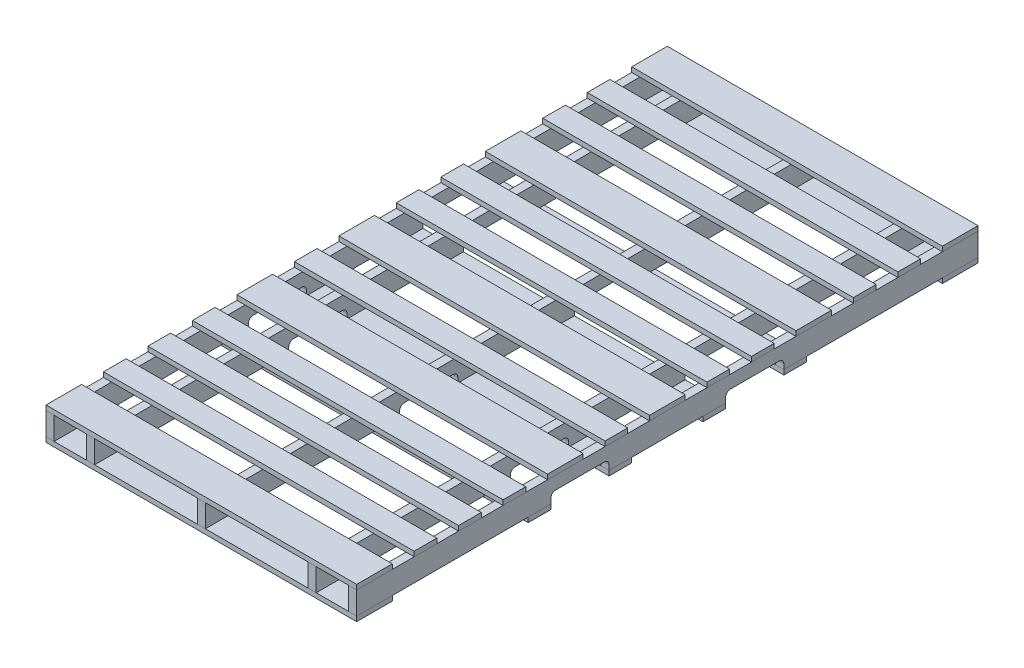
from build123d import *

# Parameters (mm, degrees)
BOSS_EXTRUDE1_DEPTH        = 1219.2
BOSS_EXTRUDE1_DEPTH_BACK   = 1219.2
SKETCH3_W                  = 31.75
SKETCH3_H                  = 88.9
BOSS_EXTRUDE1_2_DEPTH      = 1219.2
BOSS_EXTRUDE1_2_DEPTH_BACK = 1219.2
BOSS_EXTRUDE1_3_DEPTH      = 1219.2
BOSS_EXTRUDE1_3_DEPTH_BACK = 1219.2
BOSS_EXTRUDE1_4_DEPTH      = 1219.2
BOSS_EXTRUDE1_4_DEPTH_BACK = 1219.2
BOSS_EXTRUDE1_5_DEPTH      = 1219.2
BOSS_EXTRUDE1_5_DEPTH_BACK = 1219.2
SKETCH4_W                  = 1219.2
SKETCH4_H                  = 139.7
BOSS_EXTRUDE2_DEPTH        = 19.05
BOSS_EXTRUDE2_2_DEPTH      = 19.05
BOSS_EXTRUDE2_3_DEPTH      = 19.05
SKETCH4_H_2                = 88.9
BOSS_EXTRUDE2_4_DEPTH      = 19.05
BOSS_EXTRUDE2_5_DEPTH      = 19.05
BOSS_EXTRUDE2_6_DEPTH      = 19.05
BOSS_EXTRUDE2_7_DEPTH      = 19.05
BOSS_EXTRUDE2_8_DEPTH      = 19.05
BOSS_EXTRUDE2_9_DEPTH      = 19.05
BOSS_EXTRUDE2_10_DEPTH     = 19.05
BOSS_EXTRUDE2_11_DEPTH     = 19.05
BOSS_EXTRUDE2_12_DEPTH     = 19.05
BOSS_EXTRUDE2_13_DEPTH     = 19.05
SKETCH5_W                  = 1219.2
SKETCH5_H                  = 139.7
BOSS_EXTRUDE3_DEPTH        = 19.05
BOSS_EXTRUDE3_2_DEPTH      = 19.05
SKETCH5_H_2                = 88.9
BOSS_EXTRUDE3_3_DEPTH      = 19.05
BOSS_EXTRUDE3_4_DEPTH      = 19.05
BOSS_EXTRUDE3_5_DEPTH      = 19.05
BOSS_EXTRUDE3_6_DEPTH      = 19.05
CUT_EXTRUDE2_DEPTH         = 1726.378083204
CUT_EXTRUDE2_DEPTH_BACK    = 1726.378083204


with BuildPart() as part:
    # Sketch3 → Boss-Extrude1 (new, two sides: drawn at the far end of the back side and taken through both)
    with BuildSketch(Plane.XY.offset(-BOSS_EXTRUDE1_DEPTH_BACK)):
        with Locations((-593.725, 0)):
            Rectangle(SKETCH3_W, SKETCH3_H)
    extrude(amount=BOSS_EXTRUDE1_DEPTH + BOSS_EXTRUDE1_DEPTH_BACK)


with BuildPart() as body_2:
    # Sketch3 → Boss-Extrude1 2 (new, two sides: drawn at the far end of the back side and taken through both)
    with BuildSketch(Plane.XY.offset(-BOSS_EXTRUDE1_2_DEPTH_BACK)):
        with Locations((434.975, 0)):
            Rectangle(SKETCH3_W, SKETCH3_H)
    extrude(amount=BOSS_EXTRUDE1_2_DEPTH + BOSS_EXTRUDE1_2_DEPTH_BACK)


with BuildPart() as body_3:
    # Sketch3 → Boss-Extrude1 3 (new, two sides: drawn at the far end of the back side and taken through both)
    with BuildSketch(Plane.XY.offset(-BOSS_EXTRUDE1_3_DEPTH_BACK)):
        with Locations((593.725, 0)):
            Rectangle(SKETCH3_W, SKETCH3_H)
    extrude(amount=BOSS_EXTRUDE1_3_DEPTH + BOSS_EXTRUDE1_3_DEPTH_BACK)


with BuildPart() as body_4:
    # Sketch3 → Boss-Extrude1 4 (new, two sides: drawn at the far end of the back side and taken through both)
    with BuildSketch(Plane.XY.offset(-BOSS_EXTRUDE1_4_DEPTH_BACK)):
        with Locations((-434.975, 0)):
            Rectangle(SKETCH3_W, SKETCH3_H)
    extrude(amount=BOSS_EXTRUDE1_4_DEPTH + BOSS_EXTRUDE1_4_DEPTH_BACK)


with BuildPart() as body_5:
    # Sketch3 → Boss-Extrude1 5 (new, two sides: drawn at the far end of the back side and taken through both)
    with BuildSketch(Plane.XY.offset(-BOSS_EXTRUDE1_5_DEPTH_BACK)):
        Rectangle(SKETCH3_W, SKETCH3_H)
    extrude(amount=BOSS_EXTRUDE1_5_DEPTH + BOSS_EXTRUDE1_5_DEPTH_BACK)


with BuildPart() as body_6:
    # Sketch4 → Boss-Extrude2 (new body)
    with BuildSketch(Plane(origin=(0, 44.45, 0), x_dir=(1, 0, 0), z_dir=(0, 1, 0))):
        with Locations((0, -1149.35)):
            Rectangle(SKETCH4_W, SKETCH4_H)
    extrude(amount=BOSS_EXTRUDE2_DEPTH)


with BuildPart() as body_7:
    # Sketch4 → Boss-Extrude2 2 (new body)
    with BuildSketch(Plane(origin=(0, 44.45, 0), x_dir=(1, 0, 0), z_dir=(0, 1, 0))):
        with Locations((0, 1149.35)):
            Rectangle(SKETCH4_W, SKETCH4_H)
    extrude(amount=BOSS_EXTRUDE2_2_DEPTH)


with BuildPart() as body_8:
    # Sketch4 → Boss-Extrude2 3 (new body)
    with BuildSketch(Plane(origin=(0, 44.45, 0), x_dir=(1, 0, 0), z_dir=(0, 1, 0))):
        with Locations((0, -400.05)):
            Rectangle(SKETCH4_W, SKETCH4_H)
    extrude(amount=BOSS_EXTRUDE2_3_DEPTH)


with BuildPart() as body_9:
    # Sketch4 → Boss-Extrude2 4 (new body)
    with BuildSketch(Plane(origin=(0, 44.45, 0), x_dir=(1, 0, 0), z_dir=(0, 1, 0))):
        with Locations((0, -200.025)):
            Rectangle(SKETCH4_W, SKETCH4_H_2)
    extrude(amount=BOSS_EXTRUDE2_4_DEPTH)


with BuildPart() as body_10:
    # Sketch4 → Boss-Extrude2 5 (new body)
    with BuildSketch(Plane(origin=(0, 44.45, 0), x_dir=(1, 0, 0), z_dir=(0, 1, 0))):
        with Locations((0, 949.325)):
            Rectangle(SKETCH4_W, SKETCH4_H_2)
    extrude(amount=BOSS_EXTRUDE2_5_DEPTH)


with BuildPart() as body_11:
    # Sketch4 → Boss-Extrude2 6 (new body)
    with BuildSketch(Plane(origin=(0, 44.45, 0), x_dir=(1, 0, 0), z_dir=(0, 1, 0))):
        with Locations((0, 200.025)):
            Rectangle(SKETCH4_W, SKETCH4_H_2)
    extrude(amount=BOSS_EXTRUDE2_6_DEPTH)


with BuildPart() as body_12:
    # Sketch4 → Boss-Extrude2 7 (new body)
    with BuildSketch(Plane(origin=(0, 44.45, 0), x_dir=(1, 0, 0), z_dir=(0, 1, 0))):
        Rectangle(SKETCH4_W, SKETCH4_H)
    extrude(amount=BOSS_EXTRUDE2_7_DEPTH)


with BuildPart() as body_13:
    # Sketch4 → Boss-Extrude2 8 (new body)
    with BuildSketch(Plane(origin=(0, 44.45, 0), x_dir=(1, 0, 0), z_dir=(0, 1, 0))):
        with Locations((0, 774.7)):
            Rectangle(SKETCH4_W, SKETCH4_H_2)
    extrude(amount=BOSS_EXTRUDE2_8_DEPTH)


with BuildPart() as body_14:
    # Sketch4 → Boss-Extrude2 9 (new body)
    with BuildSketch(Plane(origin=(0, 44.45, 0), x_dir=(1, 0, 0), z_dir=(0, 1, 0))):
        with Locations((0, 574.675)):
            Rectangle(SKETCH4_W, SKETCH4_H)
    extrude(amount=BOSS_EXTRUDE2_9_DEPTH)


with BuildPart() as body_15:
    # Sketch4 → Boss-Extrude2 10 (new body)
    with BuildSketch(Plane(origin=(0, 44.45, 0), x_dir=(1, 0, 0), z_dir=(0, 1, 0))):
        with Locations((0, 374.65)):
            Rectangle(SKETCH4_W, SKETCH4_H_2)
    extrude(amount=BOSS_EXTRUDE2_10_DEPTH)


with BuildPart() as body_16:
    # Sketch4 → Boss-Extrude2 11 (new body)
    with BuildSketch(Plane(origin=(0, 44.45, 0), x_dir=(1, 0, 0), z_dir=(0, 1, 0))):
        with Locations((0, -600.075)):
            Rectangle(SKETCH4_W, SKETCH4_H_2)
    extrude(amount=BOSS_EXTRUDE2_11_DEPTH)


with BuildPart() as body_17:
    # Sketch4 → Boss-Extrude2 12 (new body)
    with BuildSketch(Plane(origin=(0, 44.45, 0), x_dir=(1, 0, 0), z_dir=(0, 1, 0))):
        with Locations((0, -774.7)):
            Rectangle(SKETCH4_W, SKETCH4_H_2)
    extrude(amount=BOSS_EXTRUDE2_12_DEPTH)


with BuildPart() as body_18:
    # Sketch4 → Boss-Extrude2 13 (new body)
    with BuildSketch(Plane(origin=(0, 44.45, 0), x_dir=(1, 0, 0), z_dir=(0, 1, 0))):
        with Locations((0, -949.325)):
            Rectangle(SKETCH4_W, SKETCH4_H_2)
    extrude(amount=BOSS_EXTRUDE2_13_DEPTH)


with BuildPart() as body_19:
    # Sketch5 → Boss-Extrude3 (new body)
    with BuildSketch(Plane.XZ.offset(44.45)):
        with Locations((0, 1149.35)):
            Rectangle(SKETCH5_W, SKETCH5_H)
    extrude(amount=BOSS_EXTRUDE3_DEPTH)


with BuildPart() as body_20:
    # Sketch5 → Boss-Extrude3 2 (new body)
    with BuildSketch(Plane.XZ.offset(44.45)):
        with Locations((0, -1149.35)):
            Rectangle(SKETCH5_W, SKETCH5_H)
    extrude(amount=BOSS_EXTRUDE3_2_DEPTH)


with BuildPart() as body_21:
    # Sketch5 → Boss-Extrude3 3 (new body)
    with BuildSketch(Plane.XZ.offset(44.45)):
        with Locations((0, -184.15)):
            Rectangle(SKETCH5_W, SKETCH5_H_2)
    extrude(amount=BOSS_EXTRUDE3_3_DEPTH)


with BuildPart() as body_22:
    # Sketch5 → Boss-Extrude3 4 (new body)
    with BuildSketch(Plane.XZ.offset(44.45)):
        with Locations((0, 501.65)):
            Rectangle(SKETCH5_W, SKETCH5_H_2)
    extrude(amount=BOSS_EXTRUDE3_4_DEPTH)


with BuildPart() as body_23:
    # Sketch5 → Boss-Extrude3 5 (new body)
    with BuildSketch(Plane.XZ.offset(44.45)):
        with Locations((0, -501.65)):
            Rectangle(SKETCH5_W, SKETCH5_H_2)
    extrude(amount=BOSS_EXTRUDE3_5_DEPTH)


with BuildPart() as body_24:
    # Sketch5 → Boss-Extrude3 6 (new body)
    with BuildSketch(Plane.XZ.offset(44.45)):
        with Locations((0, 184.15)):
            Rectangle(SKETCH5_W, SKETCH5_H_2)
    extrude(amount=BOSS_EXTRUDE3_6_DEPTH)


with BuildPart() as cut_extrude2_tool:
    # Sketch8 → Cut-Extrude2 (new, two sides: drawn at the far end of the back side and taken through both)
    with BuildSketch(Plane(origin=(609.6, 0, 0), x_dir=(0, 0, -1), z_dir=(1, 0, 0)).offset(-CUT_EXTRUDE2_DEPTH_BACK)):
        with BuildLine():
            Line((-228.6, -44.45), (-457.2, -44.45))
            Line((-457.2, -44.45), (-457.2, -25.4))
            ThreePointArc((-457.2, -25.4), (-451.620384182, -11.929615818), (-438.15, -6.35))
            Line((-438.15, -6.35), (-247.65, -6.35))
            ThreePointArc((-247.65, -6.35), (-234.179615818, -11.929615818), (-228.6, -25.4))
            Line((-228.6, -25.4), (-228.6, -44.45))
        make_face()
        with BuildLine():
            Line((228.6, -44.45), (457.2, -44.45))
            Line((457.2, -44.45), (457.2, -25.4))
            ThreePointArc((457.2, -25.4), (451.620384182, -11.929615818), (438.15, -6.35))
            Line((438.15, -6.35), (247.65, -6.35))
            ThreePointArc((247.65, -6.35), (234.179615818, -11.929615818), (228.6, -25.4))
            Line((228.6, -25.4), (228.6, -44.45))
        make_face()
    extrude(amount=CUT_EXTRUDE2_DEPTH + CUT_EXTRUDE2_DEPTH_BACK)


with BuildPart() as part_1:
    add(part.part)

    # Cut-Extrude2: cut by cut_extrude2_tool
    add(cut_extrude2_tool.part, mode=Mode.SUBTRACT)


with BuildPart() as body_2_1:
    add(body_2.part)

    # Cut-Extrude2: cut by cut_extrude2_tool
    add(cut_extrude2_tool.part, mode=Mode.SUBTRACT)


with BuildPart() as body_3_1:
    add(body_3.part)

    # Cut-Extrude2: cut by cut_extrude2_tool
    add(cut_extrude2_tool.part, mode=Mode.SUBTRACT)


with BuildPart() as body_4_1:
    add(body_4.part)

    # Cut-Extrude2: cut by cut_extrude2_tool
    add(cut_extrude2_tool.part, mode=Mode.SUBTRACT)


with BuildPart() as body_5_1:
    add(body_5.part)

    # Cut-Extrude2: cut by cut_extrude2_tool
    add(cut_extrude2_tool.part, mode=Mode.SUBTRACT)


solid = Compound([body_6.part, body_7.part, body_8.part, body_9.part, body_10.part, body_11.part, body_12.part, body_13.part, body_14.part, body_15.part, body_16.part, body_17.part, body_18.part, body_19.part, body_20.part, body_21.part, body_22.part, body_23.part, body_24.part, part_1.part, body_2_1.part, body_3_1.part, body_4_1.part, body_5_1.part])
